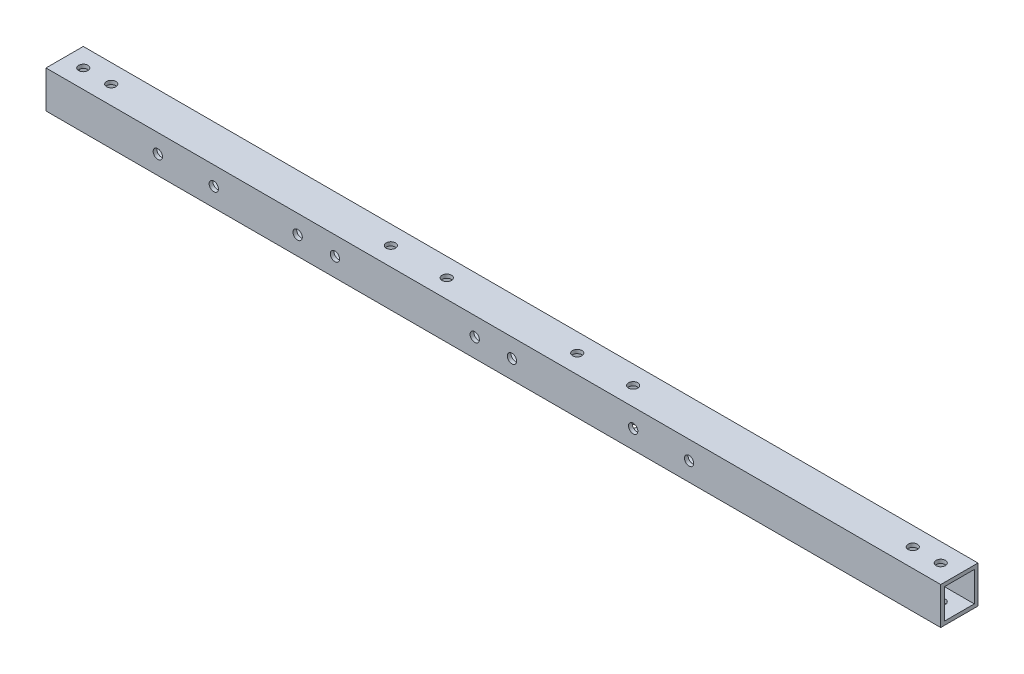
from build123d import *

# Parameters (mm, degrees)
SKETCH1_W           = 20
SKETCH1_H           = 20
SKETCH1_W_2         = 16
SKETCH1_H_2         = 16
BOSS_EXTRUDE1_DEPTH = 480
SKETCH2_R           = 2.5
CUT_EXTRUDE1_DEPTH  = 481.520551069
SKETCH3_R           = 2.5
CUT_EXTRUDE2_DEPTH  = 481.520551069
SKETCH4_R           = 2.5
CUT_EXTRUDE3_DEPTH  = 20


with BuildPart() as part:
    # Sketch1 → Boss-Extrude1 (new body)
    with BuildSketch(Plane(origin=(0, 0, 0), x_dir=(0, 0, -1), z_dir=(1, 0, 0))):
        Rectangle(SKETCH1_W, SKETCH1_H)
        Rectangle(SKETCH1_W_2, SKETCH1_H_2, mode=Mode.SUBTRACT)
    extrude(amount=BOSS_EXTRUDE1_DEPTH)

    # Sketch2 → Cut-Extrude1 (cut, through all)
    with BuildSketch(Plane(origin=(0, 10, 0), x_dir=(1, 0, 0), z_dir=(0, 1, 0))):
        with Locations(Location((10, 0, 0), (0, 0, 270))):
            Circle(SKETCH2_R)
        with Locations(Location((470, 0, 0), (0, 0, 270))):
            Circle(SKETCH2_R)
        with Locations(Location((25, 0, 0), (0, 0, 270))):
            Circle(SKETCH2_R)
        with Locations(Location((455, 0, 0), (0, 0, 270))):
            Circle(SKETCH2_R)
    extrude(amount=-CUT_EXTRUDE1_DEPTH, mode=Mode.SUBTRACT)

    # Sketch3 → Cut-Extrude2 (cut, through all)
    with BuildSketch(Plane(origin=(0, 10, 0), x_dir=(1, 0, 0), z_dir=(0, 1, 0))):
        with Locations(Location((175, 0, 0), (0, 0, 270))):
            Circle(SKETCH3_R)
        with Locations(Location((305, 0, 0), (0, 0, 270))):
            Circle(SKETCH3_R)
        with Locations(Location((205, 0, 0), (0, 0, 270))):
            Circle(SKETCH3_R)
        with Locations(Location((275, 0, 0), (0, 0, 270))):
            Circle(SKETCH3_R)
    extrude(amount=-CUT_EXTRUDE2_DEPTH, mode=Mode.SUBTRACT)

    # Sketch4 → Cut-Extrude3 (cut)
    with BuildSketch(Plane.XY.offset(10)):
        with Locations((60, 0)):
            Circle(SKETCH4_R)
        with Locations((90, 0)):
            Circle(SKETCH4_R)
        with Locations((315, 0)):
            Circle(SKETCH4_R)
        with Locations((345, 0)):
            Circle(SKETCH4_R)
        with Locations((135, 0)):
            Circle(SKETCH4_R)
        with Locations((155, 0)):
            Circle(SKETCH4_R)
        with Locations((230, 0)):
            Circle(SKETCH4_R)
        with Locations((250, 0)):
            Circle(SKETCH4_R)
    extrude(amount=-CUT_EXTRUDE3_DEPTH, mode=Mode.SUBTRACT)


solid = part.part
